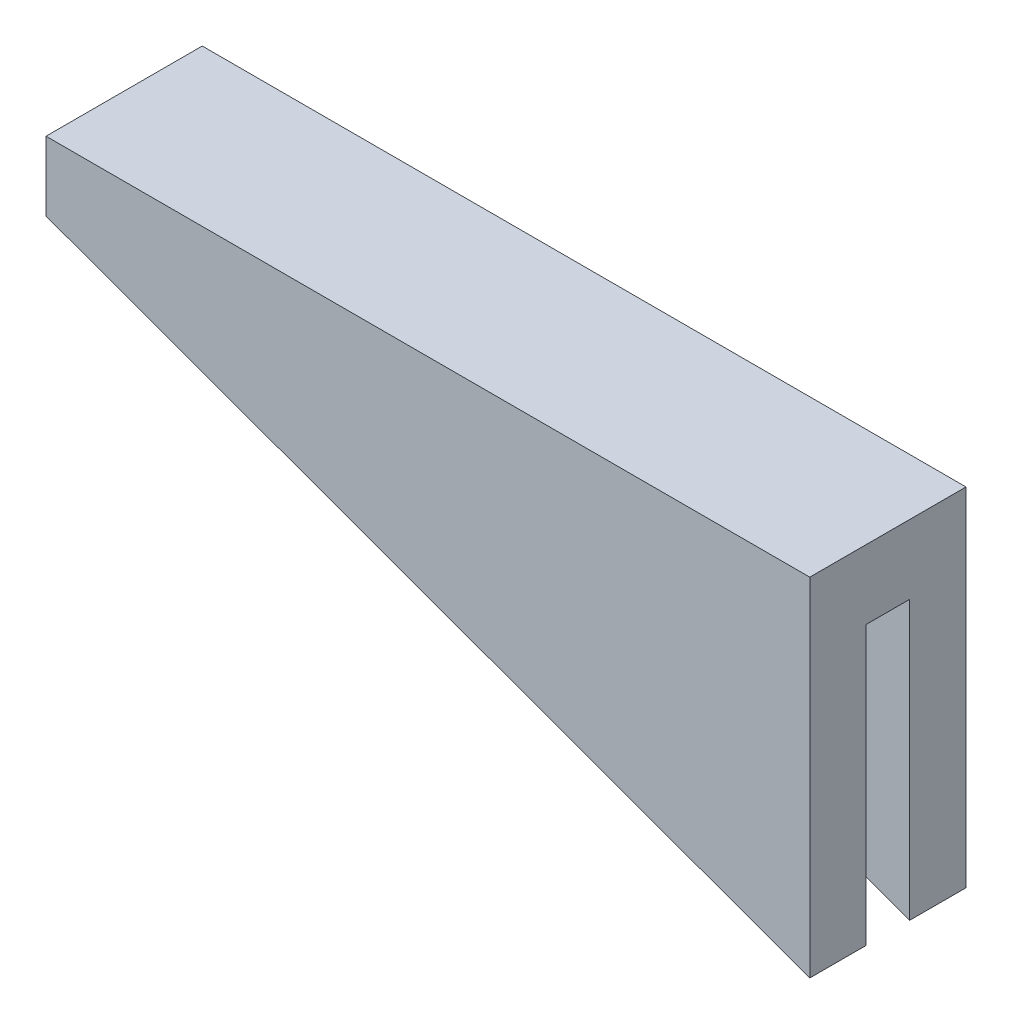
from build123d import *

# Parameters (mm, degrees)
BOSS_EXTRUDE1_DEPTH = 18
SKETCH3_W           = 5
SKETCH3_H           = 64.05876123
CUT_EXTRUDE1_DEPTH  = 111


with BuildPart() as part:
    # Sketch1 → Boss-Extrude1 (new body)
    with BuildSketch(Plane.XY):
        Polygon((0, 0), (88, 0), (88, -40), (0, -7.970619385), align=None)
    extrude(amount=BOSS_EXTRUDE1_DEPTH)

    # Sketch3 → Cut-Extrude1 (cut)
    with BuildSketch(Plane(origin=(88, 0, 0), x_dir=(0, 0, -1), z_dir=(1, 0, 0))):
        with Locations((-9, -40)):
            Rectangle(SKETCH3_W, SKETCH3_H)
    extrude(amount=-CUT_EXTRUDE1_DEPTH, mode=Mode.SUBTRACT)


solid = part.part
